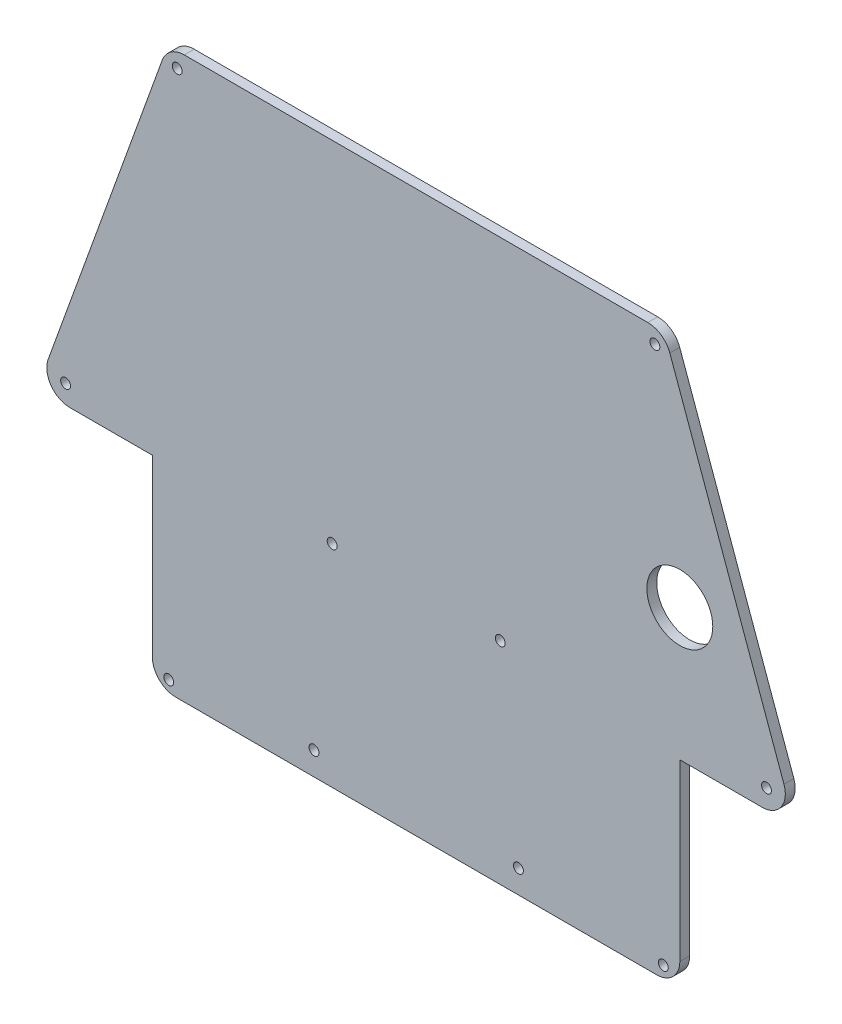
from build123d import *

# Parameters (mm, degrees)
SKETCH_2_R      = 1.5
SKETCH_2_R_2    = 10
EXTRUDE_2_DEPTH = 3


with BuildPart() as part:
    # 草图2 → 凸台-拉伸2 (new body)
    with BuildSketch(Plane.XY):
        with BuildLine():
            Line((-72.904615241, 0), (73, 0))
            ThreePointArc((73, 0), (77.949747468, 2.050252532), (80, 7))
            Line((80, 7), (80, 60))
            Line((80, 60), (105, 60))
            ThreePointArc((105, 60), (110.7284389, 62.976942983), (111.584524662, 69.375717782))
            Line((111.584524662, 69.375717782), (76.970149392, 165.31270549))
            ThreePointArc((76.970149392, 165.31270549), (74.373778179, 168.711112108), (70.295901401, 170))
            Line((70.295901401, 170), (-70.295901401, 170))
            ThreePointArc((-70.295901401, 170), (-74.373778179, 168.711112108), (-76.970149392, 165.31270549))
            Line((-76.970149392, 165.31270549), (-111.584524662, 69.375717782))
            ThreePointArc((-111.584524662, 69.375717782), (-110.7284389, 62.976942983), (-105, 60))
            Line((-105, 60), (-80, 60))
            Line((-80, 60), (-80, 7.095384759))
            ThreePointArc((-80, 7.095384759), (-77.921809919, 2.078190081), (-72.904615241, 0))
        make_face()
        with Locations((-30.952307621, 7.065749953)):
            Circle(SKETCH_2_R, mode=Mode.SUBTRACT)
        with Locations(Location((31.047692379, 7.065749953, 0), (0, 0, 180))):
            Circle(SKETCH_2_R, mode=Mode.SUBTRACT)
        with Locations((-25.452307621, 64.065749953)):
            Circle(SKETCH_2_R, mode=Mode.SUBTRACT)
        with Locations(Location((25.547692379, 64.065749953, 0), (0, 0, 180))):
            Circle(SKETCH_2_R, mode=Mode.SUBTRACT)
        with Locations((-72.441382232, 165.375717782)):
            Circle(SKETCH_2_R, mode=Mode.SUBTRACT)
        with Locations((-106.29148568, 65.75613767)):
            Circle(SKETCH_2_R, mode=Mode.SUBTRACT)
        with Locations(Location((106.29148568, 65.75613767, 0), (0, 0, 180))):
            Circle(SKETCH_2_R, mode=Mode.SUBTRACT)
        with Locations(Location((72.441382232, 165.375717782, 0), (0, 0, 180))):
            Circle(SKETCH_2_R, mode=Mode.SUBTRACT)
        with Locations((-75, 3.552033702)):
            Circle(SKETCH_2_R, mode=Mode.SUBTRACT)
        with Locations(Location((75, 3.552033702, 0), (0, 0, 180))):
            Circle(SKETCH_2_R, mode=Mode.SUBTRACT)
        with Locations((80, 100)):
            Circle(SKETCH_2_R_2, mode=Mode.SUBTRACT)
    extrude(amount=EXTRUDE_2_DEPTH)


solid = part.part
